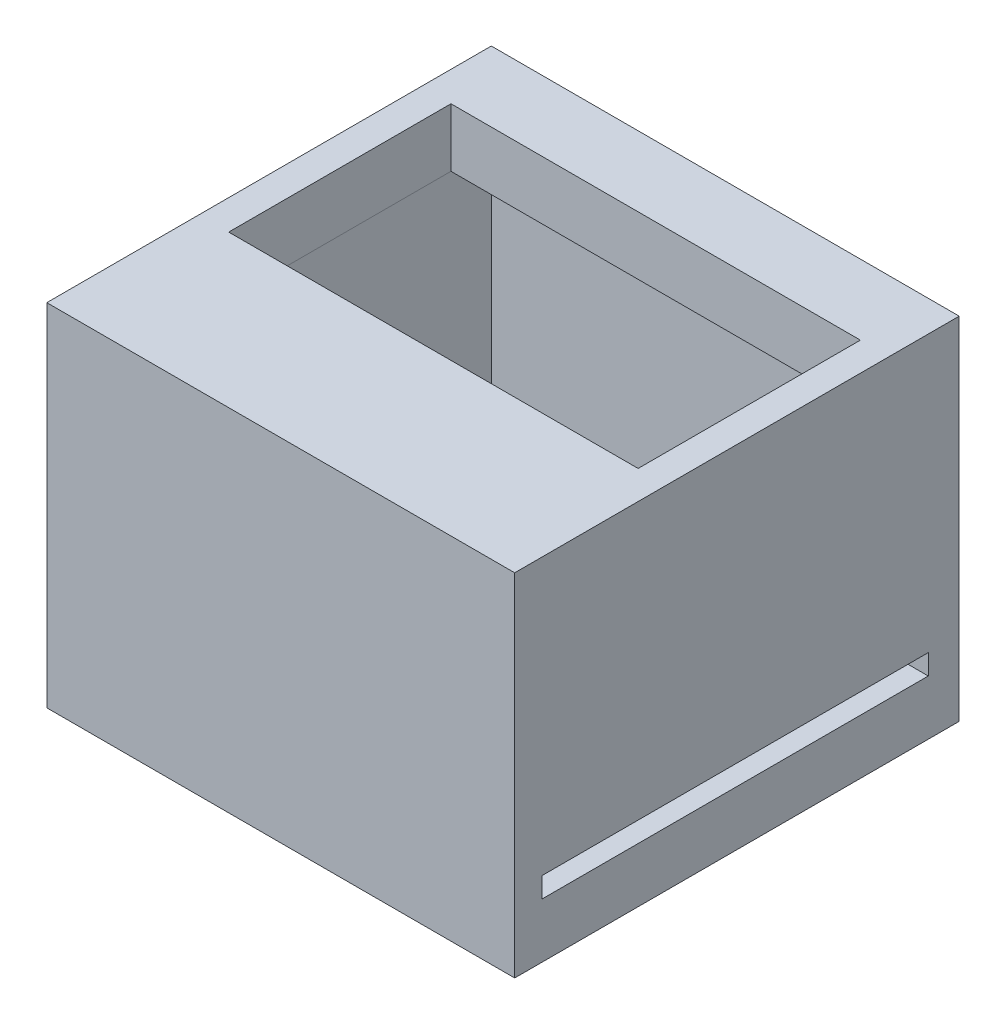
from build123d import *

# Parameters (mm, degrees)
SKETCH1_W           = 40
SKETCH1_H           = 38
BOSS_EXTRUDE2_DEPTH = 30
SKETCH3_W           = 35
SKETCH3_H           = 33
CUT_EXTRUDE1_DEPTH  = 25
SKETCH4_W           = 35
SKETCH4_H           = 19
CUT_EXTRUDE3_DEPTH  = 30
CUT_EXTRUDE4_START  = -79.225806
SKETCH5_W           = 33.033354951
SKETCH5_H           = 1.733302189
CUT_EXTRUDE4_DEPTH  = 100


with BuildPart() as part:
    # Sketch1 → Boss-Extrude2 (new body)
    with BuildSketch(Plane(origin=(0, 0, 0), x_dir=(1, 0, 0), z_dir=(0, 1, 0))):
        with Locations((0.774193548, -6.419354839)):
            Rectangle(SKETCH1_W, SKETCH1_H)
    extrude(amount=BOSS_EXTRUDE2_DEPTH)

    # Sketch3 → Cut-Extrude1 (cut)
    with BuildSketch(Plane(origin=(0, 0, 0), x_dir=(1, 0, 0), z_dir=(0, 1, 0))):
        with Locations((0.774193548, -6.419354839)):
            Rectangle(SKETCH3_W, SKETCH3_H)
    extrude(amount=CUT_EXTRUDE1_DEPTH, mode=Mode.SUBTRACT)

    # Sketch4 → Cut-Extrude3 (cut)
    with BuildSketch(Plane(origin=(0, 0, 0), x_dir=(1, 0, 0), z_dir=(0, 1, 0))):
        with Locations((0.826342552, -2.919354839)):
            Rectangle(SKETCH4_W, SKETCH4_H)
    extrude(amount=CUT_EXTRUDE3_DEPTH, mode=Mode.SUBTRACT)

    # Sketch5 → Cut-Extrude4 (cut)
    with BuildSketch(Plane(origin=(0, 0, 0), x_dir=(0, 0, -1), z_dir=(1, 0, 0)).offset(CUT_EXTRUDE4_START)):
        with Locations((-6.580047935, 5.546955331)):
            Rectangle(SKETCH5_W, SKETCH5_H)
    extrude(amount=CUT_EXTRUDE4_DEPTH, mode=Mode.SUBTRACT)


solid = part.part
